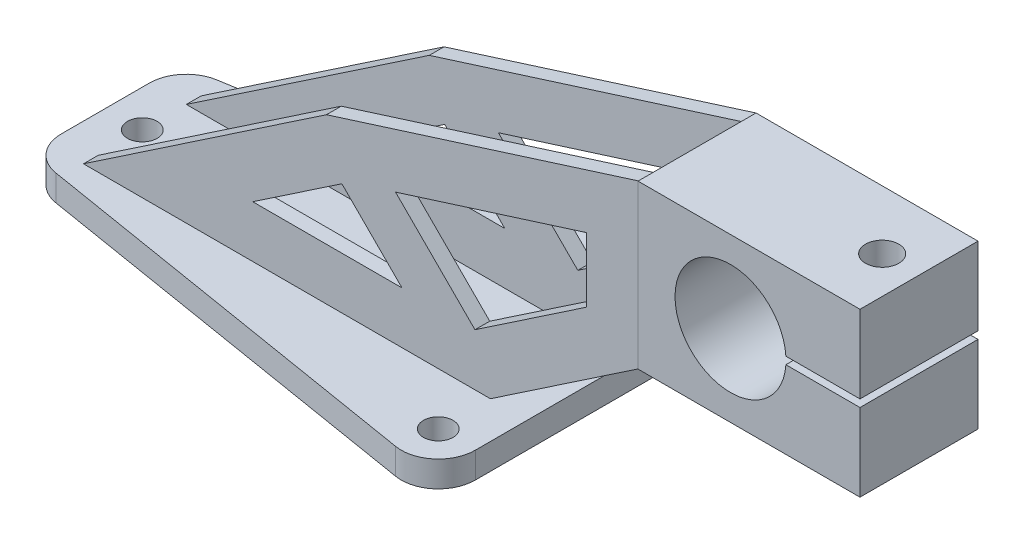
from build123d import *

# Parameters (mm, degrees)
BOSS_EXTRUDE1_DEPTH     = 2
BOSS_EXTRUDE2_START     = -31.8
SKETCH3_W               = 60
SKETCH3_H               = 44
BOSS_EXTRUDE2_DEPTH     = 31.8
SKETCH4_R               = 4
BOSS_EXTRUDE3_DEPTH     = 7
CUT_EXTRUDE1_DEPTH      = 229.617169084
CUT_EXTRUDE1_DEPTH_BACK = 229.617169084
CUT_EXTRUDE2_DEPTH      = 228.560980838
CUT_EXTRUDE2_DEPTH_BACK = 228.560980838
SKETCH8_R               = 4.5
BOSS_EXTRUDE4_DEPTH     = 0.1


with BuildPart() as part:
    # Sketch1 → Boss-Extrude1 (new, symmetric)
    with BuildSketch(Plane.XY.offset(13.9)):
        Polygon((150, 27), (150, 71), (65.671641791, 44.328358209), (0, 0), (110, 0), align=None)
        Polygon((45.764296173, 14), (69.845614914, 30.25489015), (86.100505063, 14), align=None, mode=Mode.SUBTRACT)
        Polygon((84.347754219, 35.551740718), (136, 51.888477569), (136, 34.440899917), (105.826026877, 14.073468059), align=None, mode=Mode.SUBTRACT)
    extrude(amount=BOSS_EXTRUDE1_DEPTH, both=True)


with BuildPart() as body_2:
    # Mirror2: mirrored copy
    add(part.part.mirror(Plane.XY))


with BuildPart() as part_1:
    add(part.part)

    add(body_2.part)  # Boss-Extrude2 merges body 2
    # Sketch3 → Boss-Extrude2 (add)
    with BuildSketch(Plane.XY.offset(15.9).offset(BOSS_EXTRUDE2_START)):
        with Locations((180, 49)):
            Rectangle(SKETCH3_W, SKETCH3_H)
    extrude(amount=BOSS_EXTRUDE2_DEPTH)

    # Sketch4 → Boss-Extrude3 (add)
    with BuildSketch(Plane(origin=(0, 0, 0), x_dir=(1, 0, 0), z_dir=(0, 1, 0))):
        with BuildLine():
            Line((108.3763786, 39.867312377), (-1.6236214, 21.767312377))
            ThreePointArc((-1.6236214, 21.767312377), (-7.623523267, 18.37162213), (-10, 11.9))
            Line((-10, 11.9), (-10, -11.9))
            ThreePointArc((-10, -11.9), (-7.623523267, -18.37162213), (-1.6236214, -21.767312377))
            Line((-1.6236214, -21.767312377), (108.3763786, -39.867312377))
            ThreePointArc((108.3763786, -39.867312377), (116.47162213, -37.623523267), (120, -30))
            Line((120, -30), (120, 30))
            ThreePointArc((120, 30), (116.47162213, 37.623523267), (108.3763786, 39.867312377))
        make_face()
        with Locations(Location((110, 30, 0), (0, 0, 270))):
            Circle(SKETCH4_R, mode=Mode.SUBTRACT)
        with Locations(Location((110, -30, 0), (0, 0, 270))):
            Circle(SKETCH4_R, mode=Mode.SUBTRACT)
        with Locations(Location((0, 0, 0), (0, 0, 270))):
            Circle(SKETCH4_R, mode=Mode.SUBTRACT)
    extrude(amount=-BOSS_EXTRUDE3_DEPTH)

    # Sketch7 → Cut-Extrude1 (cut, two sides: drawn at the far end of the back side and taken through both)
    with BuildSketch(Plane.XY.offset(15.9).offset(-CUT_EXTRUDE1_DEPTH_BACK)):
        with BuildLine():
            Line((189.966629547, 50), (210, 50))
            Line((210, 50), (210, 48))
            Line((210, 48), (189.966629547, 48))
            ThreePointArc((189.966629547, 48), (160, 49), (189.966629547, 50))
        make_face()
    extrude(amount=CUT_EXTRUDE1_DEPTH + CUT_EXTRUDE1_DEPTH_BACK, mode=Mode.SUBTRACT)

    # Sketch8 → Cut-Extrude2 (cut, two sides: drawn at the far end of the back side and taken through both)
    with BuildSketch(Plane(origin=(0, 71, 0), x_dir=(1, 0, 0), z_dir=(0, 1, 0)).offset(-CUT_EXTRUDE2_DEPTH_BACK)):
        with Locations(Location((200, 0, 0), (0, 0, 270))):
            Circle(SKETCH8_R)
    extrude(amount=CUT_EXTRUDE2_DEPTH + CUT_EXTRUDE2_DEPTH_BACK, mode=Mode.SUBTRACT)

    # Sketch9 → Boss-Extrude4 (add)
    with BuildSketch(Plane.XY.offset(15.9)):
        with BuildLine():
            Line((150, 71), (150, 27))
            Line((150, 27), (210, 27))
            Line((210, 27), (210, 48))
            Line((210, 48), (189.966629547, 48))
            ThreePointArc((189.966629547, 48), (160, 49), (189.966629547, 50))
            Line((189.966629547, 50), (210, 50))
            Line((210, 50), (210, 71))
            Line((210, 71), (150, 71))
        make_face()
    extrude(amount=BOSS_EXTRUDE4_DEPTH)


solid = part_1.part
